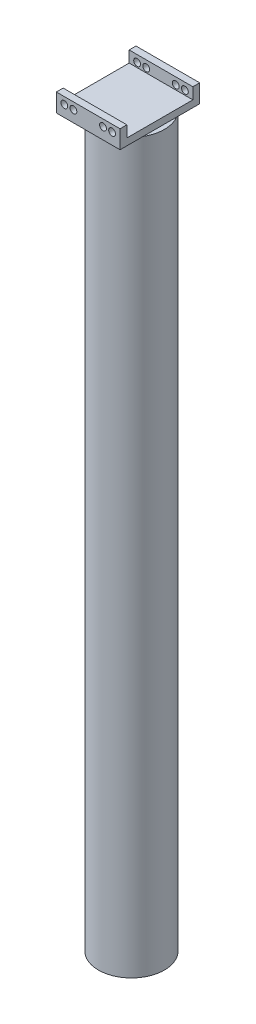
from build123d import *

# Parameters (mm, degrees)
SKETCH1_R           = 14.5
BOSS_EXTRUDE1_DEPTH = 320
SHELL1_T            = -3
SKETCH2_W           = 28
SKETCH2_H           = 8
BOSS_EXTRUDE2_DEPTH = 17.5
SKETCH4_W           = 29
SKETCH4_H           = 5
CUT_EXTRUDE1_DEPTH  = 28
CUT_EXTRUDE2_REACH  = 332.226
SKETCH5_R           = 1.5


with BuildPart() as part:
    # Sketch1 → Boss-Extrude1 (new body)
    with BuildSketch(Plane(origin=(0, 0, 0), x_dir=(1, 0, 0), z_dir=(0, 1, 0))):
        with Locations(Location((0, 0, 0), (0, 0, 270))):
            Circle(SKETCH1_R)
    extrude(amount=BOSS_EXTRUDE1_DEPTH)

    # Shell1
    shell1_openings = [part.faces().sort_by_distance(p)[0] for p in [
        (0, 320, 0),
        (0, 0, 0),
    ]]
    offset(amount=SHELL1_T, openings=shell1_openings, kind=Kind.INTERSECTION)

    # Sketch2 → Boss-Extrude2 (add, symmetric)
    with BuildSketch(Plane.XY):
        with Locations((-1.5, 324)):
            Rectangle(SKETCH2_W, SKETCH2_H)
    extrude(amount=BOSS_EXTRUDE2_DEPTH, both=True)

    # Sketch4 → Cut-Extrude1 (cut)
    with BuildSketch(Plane(origin=(12.5, 0, 0), x_dir=(0, 0, -1), z_dir=(1, 0, 0))):
        with Locations((0, 325.5)):
            Rectangle(SKETCH4_W, SKETCH4_H)
    extrude(amount=-CUT_EXTRUDE1_DEPTH, mode=Mode.SUBTRACT)

    # Cut-Extrude2: up to this face of the body (flat: up to its plane)
    cut_extrude2_end = Plane(part.part.faces().sort_by_distance((-1.5, 324, -17.5))[0])
    # Sketch5 → Cut-Extrude2 (cut, up to the picked face)
    with BuildSketch(Plane.XY.offset(17.5), mode=Mode.PRIVATE) as cut_extrude2_sk1:
        with Locations((-8, 325)):
            Circle(SKETCH5_R)
    cut_extrude2_tool1 = split(extrude(cut_extrude2_sk1.sketch, amount=-CUT_EXTRUDE2_REACH, mode=Mode.PRIVATE), bisect_by=cut_extrude2_end, keep=Keep.BOTH, mode=Mode.PRIVATE)
    # Sketch5 → Cut-Extrude2 (cut, up to the picked face)
    with BuildSketch(Plane.XY.offset(17.5), mode=Mode.PRIVATE) as cut_extrude2_sk2:
        with Locations((5, 325)):
            Circle(SKETCH5_R)
    cut_extrude2_tool2 = split(extrude(cut_extrude2_sk2.sketch, amount=-CUT_EXTRUDE2_REACH, mode=Mode.PRIVATE), bisect_by=cut_extrude2_end, keep=Keep.BOTH, mode=Mode.PRIVATE)
    # Sketch5 → Cut-Extrude2 (cut, up to the picked face)
    with BuildSketch(Plane.XY.offset(17.5), mode=Mode.PRIVATE) as cut_extrude2_sk3:
        with Locations((9, 325)):
            Circle(SKETCH5_R)
    cut_extrude2_tool3 = split(extrude(cut_extrude2_sk3.sketch, amount=-CUT_EXTRUDE2_REACH, mode=Mode.PRIVATE), bisect_by=cut_extrude2_end, keep=Keep.BOTH, mode=Mode.PRIVATE)
    # Sketch5 → Cut-Extrude2 (cut, up to the picked face)
    with BuildSketch(Plane.XY.offset(17.5), mode=Mode.PRIVATE) as cut_extrude2_sk4:
        with Locations((-12, 325)):
            Circle(SKETCH5_R)
    cut_extrude2_tool4 = split(extrude(cut_extrude2_sk4.sketch, amount=-CUT_EXTRUDE2_REACH, mode=Mode.PRIVATE), bisect_by=cut_extrude2_end, keep=Keep.BOTH, mode=Mode.PRIVATE)
    add(cut_extrude2_tool1.solids().sort_by(Axis((-8, 325, 17.5), (0, 0, -1)))[0], mode=Mode.SUBTRACT)
    add(cut_extrude2_tool2.solids().sort_by(Axis((5, 325, 17.5), (0, 0, -1)))[0], mode=Mode.SUBTRACT)
    add(cut_extrude2_tool3.solids().sort_by(Axis((9, 325, 17.5), (0, 0, -1)))[0], mode=Mode.SUBTRACT)
    add(cut_extrude2_tool4.solids().sort_by(Axis((-12, 325, 17.5), (0, 0, -1)))[0], mode=Mode.SUBTRACT)


solid = part.part
